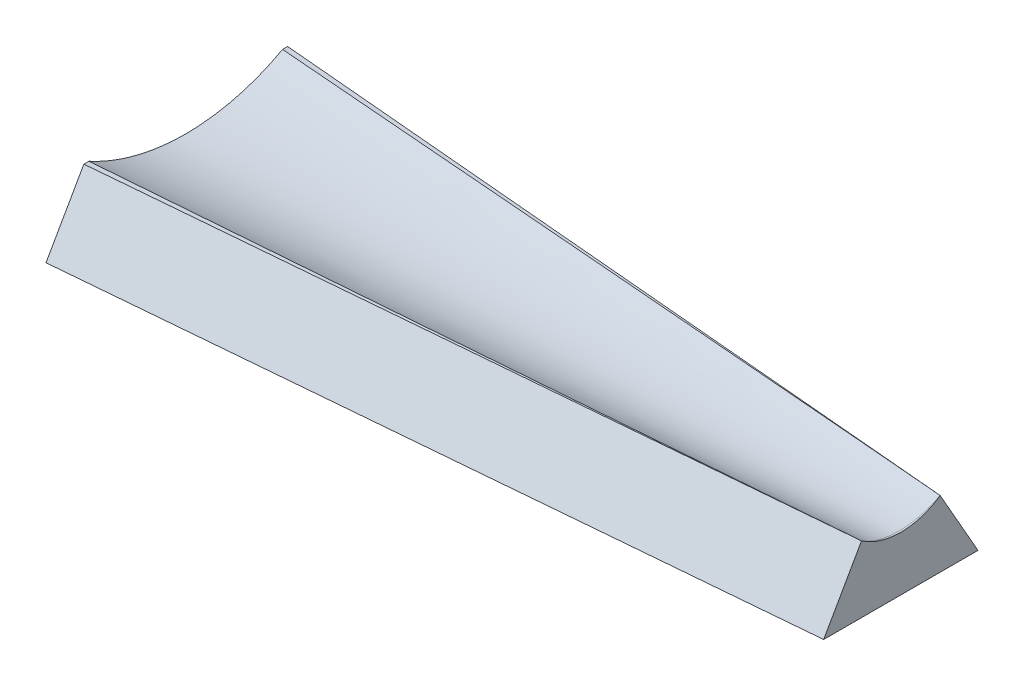
from build123d import *

# Parameters (mm, degrees)
BOSS_EXTRUDE1_DEPTH     = 19.05
BOSS_EXTRUDE1_DRAFT     = 29.55
CUT_EXTRUDE1_DEPTH      = 226.867324057
CUT_EXTRUDE1_DEPTH_BACK = 226.867324057
SKETCH2_OUTSIDE_W       = 274.774
SKETCH2_OUTSIDE_H       = 69.024
SKETCH2_OUTSIDE_W_2     = 203.2
SKETCH2_OUTSIDE_H_2     = 18.896108653
SKETCH4_R               = 19.414391595
CUT_EXTRUDE2_DEPTH      = 212.8485235
CUT_EXTRUDE2_TAPER      = -10.5


with BuildPart() as part:
    # Sketch1 → Boss-Extrude1 (with draft: the straight prism first)
    with BuildSketch(Plane(origin=(0, 0, 0), x_dir=(1, 0, 0), z_dir=(0, 1, 0))):
        Polygon((0, 0), (203.2, 17.777696428), (203.2, 40.129696428), (0, 57.907392857), align=None)
    extrude(amount=-BOSS_EXTRUDE1_DEPTH)
    # Boss-Extrude1: the draft: its side faces are tilted about the plane it starts from
    boss_extrude1_sides = [part.faces().sort_by_distance(p)[0] for p in [
        (101.6, -9.525, -8.888848214),
        (203.2, -9.525, -28.953696428),
        (101.6, -9.525, -49.018544643),
        (0, -9.525, -28.953696428),
    ]]
    draft(boss_extrude1_sides, Plane(origin=(0, 0, 0), x_dir=(1, 0, 0), z_dir=(0, 1, 0)), BOSS_EXTRUDE1_DRAFT)

    # Sketch2 outside → Cut-Extrude1 (cut, two sides: drawn at the far end of the back side and taken through both)
    with BuildSketch(Plane.XY.offset(-CUT_EXTRUDE1_DEPTH_BACK)):
        with Locations((101.6, -9.525)):
            Rectangle(SKETCH2_OUTSIDE_W, SKETCH2_OUTSIDE_H)
        with Locations((101.6, -9.448054327)):
            Rectangle(SKETCH2_OUTSIDE_W_2, SKETCH2_OUTSIDE_H_2, mode=Mode.SUBTRACT)
    extrude(amount=CUT_EXTRUDE1_DEPTH + CUT_EXTRUDE1_DEPTH_BACK, mode=Mode.SUBTRACT)

    # Sketch4 → Cut-Extrude2 (cut)
    with BuildSketch(Plane(origin=(197.664687281, -33.077724493, 0), x_dir=(0, 0, -1), z_dir=(0.9862856015372313, -0.16504760586067801, 0))):
        with Locations((28.953696428, 49.412673511)):
            Circle(SKETCH4_R)
    extrude(amount=-CUT_EXTRUDE2_DEPTH, taper=CUT_EXTRUDE2_TAPER, mode=Mode.SUBTRACT)

    # Cut-Extrude2 cone 1 section (through the dimple's axis) → Cut-Extrude2 other way (revolve, cut)
    with BuildSketch(Plane(origin=(205.820130743, 15.657283924, -28.953696428), x_dir=(0, 0, 1), z_dir=(0.165047606, 0.986285602, 0))):
        Polygon((0, 0), (19.414391595, 0), (0, 116.01582945), align=None)
    revolve(axis=Axis((205.820130743, 15.657283924, -28.953696428), (0.986285602, -0.165047606, 0)), mode=Mode.SUBTRACT)


solid = part.part
